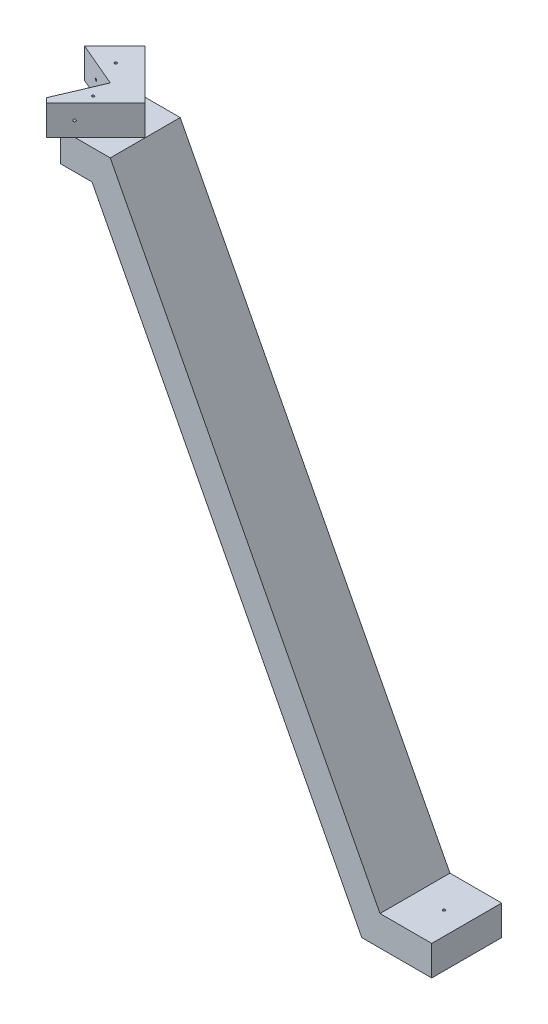
from build123d import *

# Parameters (mm, degrees)
BOSS_EXTRUDE1_DEPTH          = 44.45
F_1_8_0_125_DIAMETER_HOLE1_D = 3.175
BOSS_EXTRUDE2_DEPTH          = 38.1
CUT_EXTRUDE1_DEPTH           = 800.080150326
CUT_EXTRUDE1_DEPTH_BACK      = 800.080150326
F_1_8_0_125_DIAMETER_HOLE2_D = 3.175
F_1_8_0_125_DIAMETER_HOLE3_D = 3.175
F_1_8_0_125_DIAMETER_HOLE4_D = 3.175


with BuildPart() as part:
    # Sketch1 → Boss-Extrude1 (new, symmetric)
    with BuildSketch(Plane.XY):
        Polygon((0, 0), (-342.9, 660.4), (-408.652925072, 660.4), (-408.652925072, 698.5), (-319.752925072, 698.5), (23.147074928, 38.1), (88.9, 38.1), (88.9, 0), align=None)
    extrude(amount=BOSS_EXTRUDE1_DEPTH, both=True)

    # 1/8 (0.125) Diameter Hole1 (through all)
    with Locations(Plane(origin=(60.1472, 38.1, 0), x_dir=(0, 0, 1), z_dir=(0, 1, 0))):
        with Locations((0, 0)):
            Hole(F_1_8_0_125_DIAMETER_HOLE1_D / 2)

    # Sketch4 → Boss-Extrude2 (add)
    with BuildSketch(Plane(origin=(0, 698.5, 0), x_dir=(1, 0, 0), z_dir=(0, 1, 0))):
        Polygon((-382.614717919, 62.861792847), (-319.752925072, 0), (-382.614717919, -62.861792847), (-445.476510767, 0), align=None)
    extrude(amount=BOSS_EXTRUDE2_DEPTH)

    # Sketch6 → Cut-Extrude1 (cut, two sides: drawn at the far end of the back side and taken through both)
    with BuildSketch(Plane.XZ.offset(-660.4).offset(-CUT_EXTRUDE1_DEPTH_BACK)):
        Polygon((-445.476510767, 190.368300991), (-364.202925072, 0), (-445.476510767, -34.697981215), align=None)
    extrude(amount=CUT_EXTRUDE1_DEPTH + CUT_EXTRUDE1_DEPTH_BACK, mode=Mode.SUBTRACT)

    # 1/8 (0.125) Diameter Hole2 (through all)
    with Locations(Plane(origin=(-159.876462536, 0, -159.876462536), x_dir=(0.707106781186549, 0, -0.707106781186546), z_dir=(0.707106781186546, 0, 0.707106781186549))):
        with Locations((-289.599461622, 717.55)):
            Hole(F_1_8_0_125_DIAMETER_HOLE2_D / 2)

    # 1/8 (0.125) Diameter Hole3 (through all)
    with Locations(Plane(origin=(-159.876462536, 0, 159.876462536), x_dir=(-0.707106781186549, 0, -0.707106781186546), z_dir=(0.707106781186546, 0, -0.707106781186549))):
        with Locations((289.599461622, 717.55)):
            Hole(F_1_8_0_125_DIAMETER_HOLE3_D / 2)

    # 1/8 (0.125) Diameter Hole4 (through all)
    with Locations(Plane(origin=(0, 660.4, 0), x_dir=(-1, 0, 0), z_dir=(0, -1, 0))):
        with Locations((360.68, -25.4), (382.614717919, 25.4)):
            Hole(F_1_8_0_125_DIAMETER_HOLE4_D / 2)


solid = part.part
